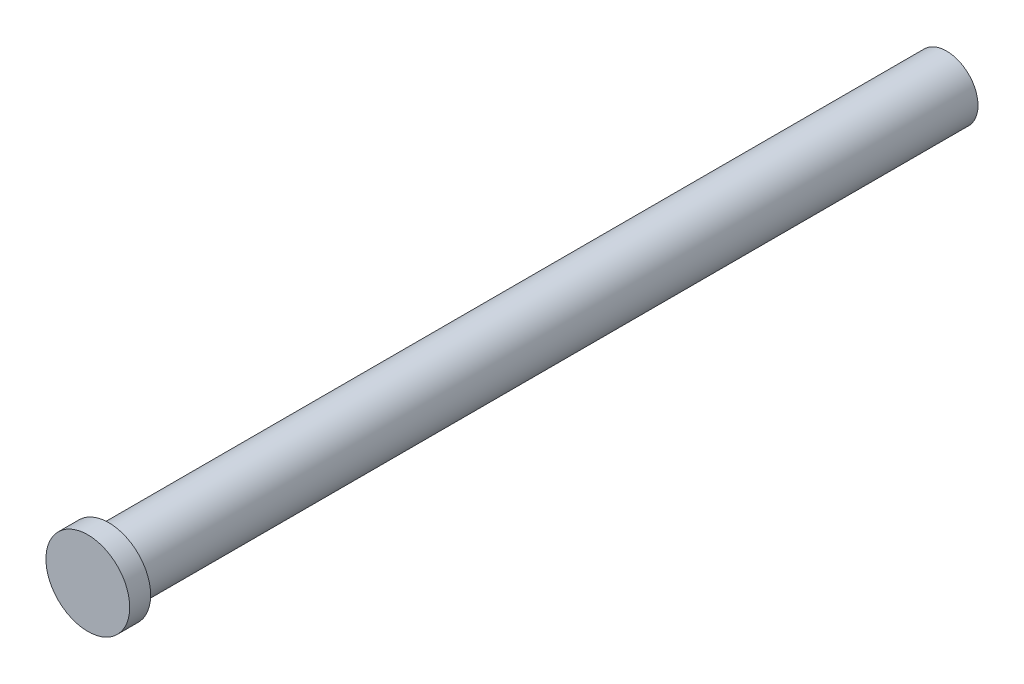
from build123d import *

# Parameters (mm, degrees)
ESQUISSE1_R        = 3
BOSS_EXTRU_1_DEPTH = 80
ESQUISSE2_R        = 4
BOSS_EXTRU_2_DEPTH = 2


with BuildPart() as part:
    # Esquisse1 → Boss.-Extru.1 (new body)
    with BuildSketch(Plane.XY):
        Circle(ESQUISSE1_R)
    extrude(amount=BOSS_EXTRU_1_DEPTH)

    # Esquisse2 → Boss.-Extru.2 (add)
    with BuildSketch(Plane.XY.offset(80)):
        Circle(ESQUISSE2_R)
    extrude(amount=BOSS_EXTRU_2_DEPTH)


solid = part.part
